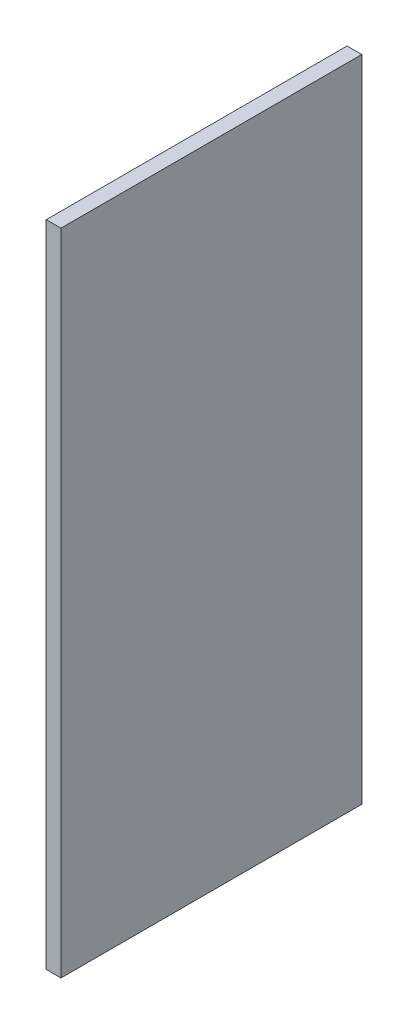
from build123d import *

# Parameters (mm, degrees)
SKETCH1_W                  = 40
SKETCH1_H                  = 1767
TOPPING_PU_YAN_SAG_1_DEPTH = 818.5


with BuildPart() as part:
    # Sketch1 → TOPPING_pu_yan_sag_1 (new body)
    with BuildSketch(Plane.XY):
        with Locations((678.5, 1085)):
            Rectangle(SKETCH1_W, SKETCH1_H)
    extrude(amount=-TOPPING_PU_YAN_SAG_1_DEPTH)


solid = part.part
